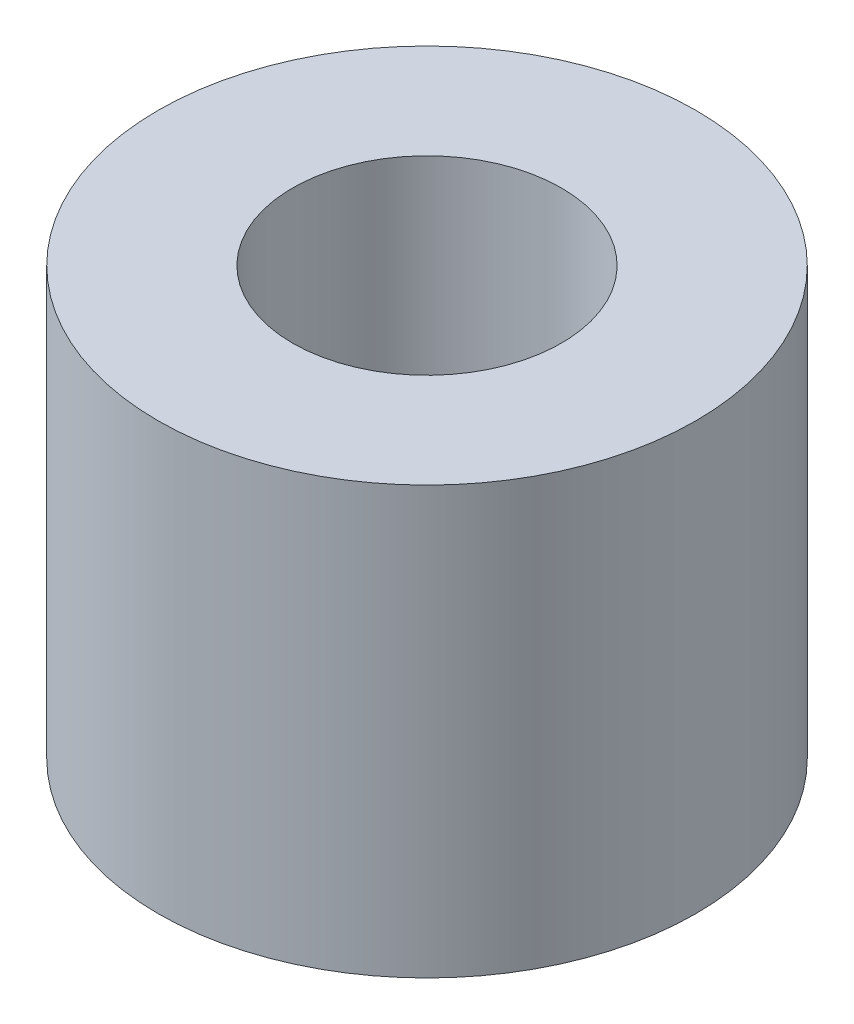
from build123d import *

# Parameters (mm, degrees)
SKETCH1_R           = 4
SKETCH1_R_2         = 2
BOSS_EXTRUDE1_DEPTH = 6.35


with BuildPart() as part:
    # Sketch1 → Boss-Extrude1 (new body)
    with BuildSketch(Plane(origin=(0, 0, 0), x_dir=(1, 0, 0), z_dir=(0, 1, 0))):
        with Locations(Location((0, 0, 0), (0, 0, 270))):
            Circle(SKETCH1_R)
        with Locations(Location((0, 0, 0), (0, 0, 270))):
            Circle(SKETCH1_R_2, mode=Mode.SUBTRACT)
    extrude(amount=BOSS_EXTRUDE1_DEPTH)


solid = part.part
